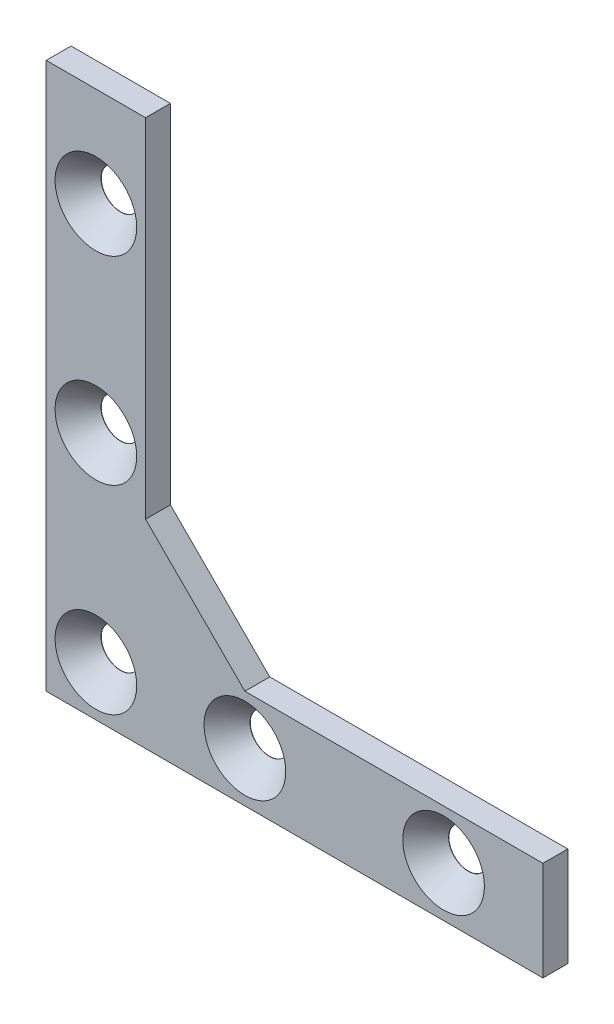
from build123d import *

# Parameters (mm, degrees)
BOSS_EXTRUDE1_DEPTH             = 3.175
F_10_CLEARANCE_HOLE1_AT_2_COUNT = 2
F_10_CLEARANCE_HOLE1_AT_2_PITCH = 25.4
F_10_CLEARANCE_HOLE1_AT_3_COUNT = 2
F_10_CLEARANCE_HOLE1_AT_3_PITCH = 50.761770585
F_10_CLEARANCE_HOLE1_AT_4_COUNT = 2
F_10_CLEARANCE_HOLE1_AT_4_PITCH = 19.05
F_10_CLEARANCE_HOLE1_AT_5_COUNT = 2
F_10_CLEARANCE_HOLE1_AT_5_PITCH = 44.45


with BuildPart() as part:
    # Sketch1 → Boss-Extrude1 (new body)
    with BuildSketch(Plane.XY):
        Polygon((-273.453367516, -6.35), (-273.453367516, 63.5), (-260.753367516, 63.5), (-260.753367516, 19.05), (-248.053367516, 6.35), (-209.953367516, 6.35), (-209.953367516, -6.35), align=None)
    extrude(amount=BOSS_EXTRUDE1_DEPTH)

    # Sketch4 → #10 Clearance Hole1 (revolve, cut)
    with BuildSketch(Plane(origin=(-267.103367516, 0.038229415, 3.175), x_dir=(0, -1, 0), z_dir=(1, 0, 0))):
        Polygon((0, 0), (0, 3.175), (2.4892, 3.175), (2.4892, 3.141080936), (5.2197, 0), align=None)
    f_10_clearance_hole1 = revolve(axis=Axis((-267.103367516, 0.038229415, 9.525), (0, 0, -1)), mode=Mode.SUBTRACT)

    # #10 Clearance Hole1 at 2: #10 Clearance Hole1 ×2
    with Locations(*[(0, i * F_10_CLEARANCE_HOLE1_AT_2_PITCH, 0) for i in range(1, F_10_CLEARANCE_HOLE1_AT_2_COUNT)]):
        add(f_10_clearance_hole1, mode=Mode.SUBTRACT)

    # #10 Clearance Hole1 at 3: #10 Clearance Hole1 ×2
    with Locations(*[(0, i * F_10_CLEARANCE_HOLE1_AT_3_PITCH, 0) for i in range(1, F_10_CLEARANCE_HOLE1_AT_3_COUNT)]):
        add(f_10_clearance_hole1, mode=Mode.SUBTRACT)

    # #10 Clearance Hole1 at 4: #10 Clearance Hole1 ×2
    with Locations(*[(i * F_10_CLEARANCE_HOLE1_AT_4_PITCH, 0, 0) for i in range(1, F_10_CLEARANCE_HOLE1_AT_4_COUNT)]):
        add(f_10_clearance_hole1, mode=Mode.SUBTRACT)

    # #10 Clearance Hole1 at 5: #10 Clearance Hole1 ×2
    with Locations(*[(i * F_10_CLEARANCE_HOLE1_AT_5_PITCH, 0, 0) for i in range(1, F_10_CLEARANCE_HOLE1_AT_5_COUNT)]):
        add(f_10_clearance_hole1, mode=Mode.SUBTRACT)


solid = part.part
